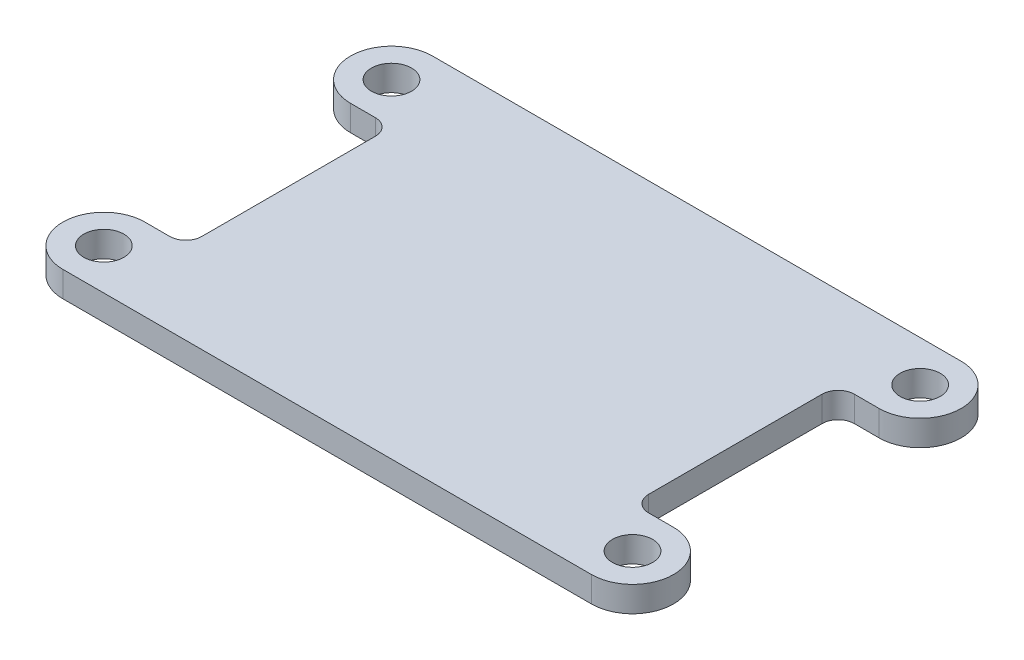
from build123d import *

# Parameters (mm, degrees)
SKETCH1_W           = 38
SKETCH1_H           = 23
BOSS_EXTRUDE1_DEPTH = 1.5875
CUT_EXTRUDE1_REACH  = 24.266
SKETCH2_R           = 1.25


with BuildPart() as part:
    # Sketch1 → Boss-Extrude1 (new body)
    with BuildSketch(Plane(origin=(0, 0, 0), x_dir=(1, 0, 0), z_dir=(0, 1, 0))):
        Rectangle(SKETCH1_W, SKETCH1_H)
    extrude(amount=BOSS_EXTRUDE1_DEPTH)

    # Sketch2 → Cut-Extrude1 (cut, up to next)
    with BuildSketch(Plane(origin=(0, 1.5875, 0), x_dir=(1, 0, 0), z_dir=(0, 1, 0)), mode=Mode.PRIVATE) as cut_extrude1_sk1:
        with BuildLine():
            Line((-19, 11.5), (-19, 8.95))
            ThreePointArc((-19, 8.95), (-18.253122292, 10.753122292), (-16.45, 11.5))
            Line((-16.45, 11.5), (-19, 11.5))
        make_face()
    cut_extrude1_tool1 = extrude(cut_extrude1_sk1.sketch, amount=-CUT_EXTRUDE1_REACH, mode=Mode.PRIVATE) & part.part
    # Sketch2 → Cut-Extrude1 (cut, up to next)
    with BuildSketch(Plane(origin=(0, 1.5875, 0), x_dir=(1, 0, 0), z_dir=(0, 1, 0)), mode=Mode.PRIVATE) as cut_extrude1_sk2:
        with Locations(Location((-16.45, 8.95, 0), (0, 0, 270))):
            Circle(SKETCH2_R)
    cut_extrude1_tool2 = extrude(cut_extrude1_sk2.sketch, amount=-CUT_EXTRUDE1_REACH, mode=Mode.PRIVATE) & part.part
    # Sketch2 → Cut-Extrude1 (cut, up to next)
    with BuildSketch(Plane(origin=(0, 1.5875, 0), x_dir=(1, 0, 0), z_dir=(0, 1, 0)), mode=Mode.PRIVATE) as cut_extrude1_sk3:
        with BuildLine():
            Line((-14.9, 6.4), (-16.45, 6.4))
            ThreePointArc((-16.45, 6.4), (-18.253122292, 7.146877708), (-19, 8.95))
            Line((-19, 8.95), (-19, -8.95))
            ThreePointArc((-19, -8.95), (-18.253122292, -7.146877708), (-16.45, -6.4))
            Line((-16.45, -6.4), (-14.9, -6.4))
            ThreePointArc((-14.9, -6.4), (-14.192893219, -6.107106781), (-13.9, -5.4))
            Line((-13.9, -5.4), (-13.9, 5.4))
            ThreePointArc((-13.9, 5.4), (-14.192893219, 6.107106781), (-14.9, 6.4))
        make_face()
    cut_extrude1_tool3 = extrude(cut_extrude1_sk3.sketch, amount=-CUT_EXTRUDE1_REACH, mode=Mode.PRIVATE) & part.part
    # Sketch2 → Cut-Extrude1 (cut, up to next)
    with BuildSketch(Plane(origin=(0, 1.5875, 0), x_dir=(1, 0, 0), z_dir=(0, 1, 0)), mode=Mode.PRIVATE) as cut_extrude1_sk4:
        with BuildLine():
            ThreePointArc((-16.45, -11.5), (-18.253122292, -10.753122292), (-19, -8.95))
            Line((-19, -8.95), (-19, -11.5))
            Line((-19, -11.5), (-16.45, -11.5))
        make_face()
    cut_extrude1_tool4 = extrude(cut_extrude1_sk4.sketch, amount=-CUT_EXTRUDE1_REACH, mode=Mode.PRIVATE) & part.part
    # Sketch2 → Cut-Extrude1 (cut, up to next)
    with BuildSketch(Plane(origin=(0, 1.5875, 0), x_dir=(1, 0, 0), z_dir=(0, 1, 0)), mode=Mode.PRIVATE) as cut_extrude1_sk5:
        with Locations(Location((-16.45, -8.95, 0), (0, 0, 270))):
            Circle(SKETCH2_R)
    cut_extrude1_tool5 = extrude(cut_extrude1_sk5.sketch, amount=-CUT_EXTRUDE1_REACH, mode=Mode.PRIVATE) & part.part
    # Sketch2 → Cut-Extrude1 (cut, up to next)
    with BuildSketch(Plane(origin=(0, 1.5875, 0), x_dir=(1, 0, 0), z_dir=(0, 1, 0)), mode=Mode.PRIVATE) as cut_extrude1_sk6:
        with Locations(Location((16.45, -8.95, 0), (0, 0, 270))):
            Circle(SKETCH2_R)
    cut_extrude1_tool6 = extrude(cut_extrude1_sk6.sketch, amount=-CUT_EXTRUDE1_REACH, mode=Mode.PRIVATE) & part.part
    # Sketch2 → Cut-Extrude1 (cut, up to next)
    with BuildSketch(Plane(origin=(0, 1.5875, 0), x_dir=(1, 0, 0), z_dir=(0, 1, 0)), mode=Mode.PRIVATE) as cut_extrude1_sk7:
        with BuildLine():
            ThreePointArc((19, -8.95), (18.253122304, -10.75312228), (16.450000035, -11.5))
            Line((16.450000035, -11.5), (19, -11.5))
            Line((19, -11.5), (19, -8.95))
        make_face()
    cut_extrude1_tool7 = extrude(cut_extrude1_sk7.sketch, amount=-CUT_EXTRUDE1_REACH, mode=Mode.PRIVATE) & part.part
    # Sketch2 → Cut-Extrude1 (cut, up to next)
    with BuildSketch(Plane(origin=(0, 1.5875, 0), x_dir=(1, 0, 0), z_dir=(0, 1, 0)), mode=Mode.PRIVATE) as cut_extrude1_sk8:
        with BuildLine():
            Line((19, -8.95), (19, 8.95))
            ThreePointArc((19, 8.95), (18.253122292, 7.146877708), (16.45, 6.4))
            Line((16.45, 6.4), (14.9, 6.4))
            ThreePointArc((14.9, 6.4), (14.192893219, 6.107106781), (13.9, 5.4))
            Line((13.9, 5.4), (13.9, -5.4))
            ThreePointArc((13.9, -5.4), (14.192893219, -6.107106781), (14.9, -6.4))
            Line((14.9, -6.4), (16.45, -6.4))
            ThreePointArc((16.45, -6.4), (18.253122292, -7.146877708), (19, -8.95))
        make_face()
    cut_extrude1_tool8 = extrude(cut_extrude1_sk8.sketch, amount=-CUT_EXTRUDE1_REACH, mode=Mode.PRIVATE) & part.part
    # Sketch2 → Cut-Extrude1 (cut, up to next)
    with BuildSketch(Plane(origin=(0, 1.5875, 0), x_dir=(1, 0, 0), z_dir=(0, 1, 0)), mode=Mode.PRIVATE) as cut_extrude1_sk9:
        with BuildLine():
            Line((19, 11.5), (16.45, 11.5))
            ThreePointArc((16.45, 11.5), (18.253122292, 10.753122292), (19, 8.95))
            Line((19, 8.95), (19, 11.5))
        make_face()
    cut_extrude1_tool9 = extrude(cut_extrude1_sk9.sketch, amount=-CUT_EXTRUDE1_REACH, mode=Mode.PRIVATE) & part.part
    # Sketch2 → Cut-Extrude1 (cut, up to next)
    with BuildSketch(Plane(origin=(0, 1.5875, 0), x_dir=(1, 0, 0), z_dir=(0, 1, 0)), mode=Mode.PRIVATE) as cut_extrude1_sk10:
        with Locations(Location((16.45, 8.95, 0), (0, 0, 270))):
            Circle(SKETCH2_R)
    cut_extrude1_tool10 = extrude(cut_extrude1_sk10.sketch, amount=-CUT_EXTRUDE1_REACH, mode=Mode.PRIVATE) & part.part
    add(cut_extrude1_tool1.solids().sort_by_distance((-18.430412, 1.5875, -10.930412))[0], mode=Mode.SUBTRACT)
    add(cut_extrude1_tool2.solids().sort_by_distance((-16.45, 1.5875, -8.95))[0], mode=Mode.SUBTRACT)
    add(cut_extrude1_tool3.solids().sort_by_distance((-16.546475, 1.5875, 0))[0], mode=Mode.SUBTRACT)
    add(cut_extrude1_tool4.solids().sort_by_distance((-18.430412, 1.5875, 10.930412))[0], mode=Mode.SUBTRACT)
    add(cut_extrude1_tool5.solids().sort_by_distance((-16.45, 1.5875, 8.95))[0], mode=Mode.SUBTRACT)
    add(cut_extrude1_tool6.solids().sort_by_distance((16.45, 1.5875, 8.95))[0], mode=Mode.SUBTRACT)
    add(cut_extrude1_tool7.solids().sort_by_distance((18.430412, 1.5875, 10.930412))[0], mode=Mode.SUBTRACT)
    add(cut_extrude1_tool8.solids().sort_by_distance((16.546475, 1.5875, 0))[0], mode=Mode.SUBTRACT)
    add(cut_extrude1_tool9.solids().sort_by_distance((18.430412, 1.5875, -10.930412))[0], mode=Mode.SUBTRACT)
    add(cut_extrude1_tool10.solids().sort_by_distance((16.45, 1.5875, -8.95))[0], mode=Mode.SUBTRACT)


solid = part.part
